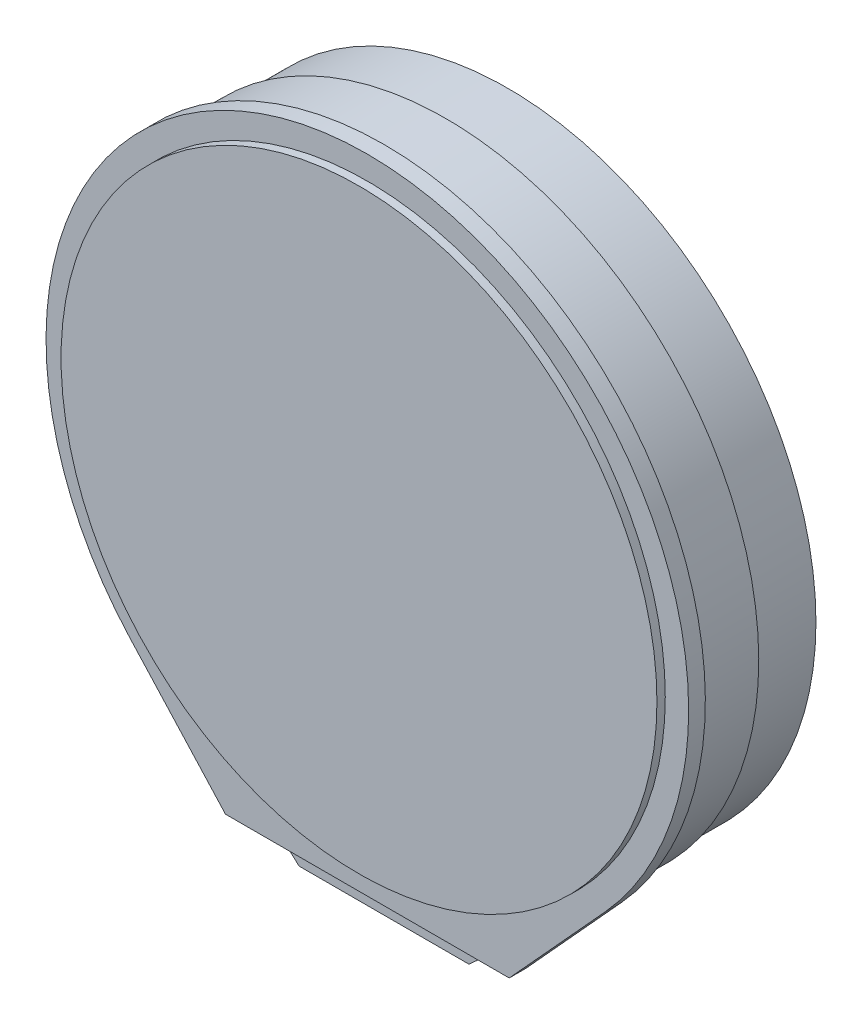
from build123d import *

# Parameters (mm, degrees)
EXTRUDE_1_DEPTH             = 3.7
EXTRUDE_2_DEPTH             = 1
SKETCH_3_R                  = 17.85
EXTRUDE_3_DEPTH             = 0.5
SKETCH_4_R                  = 18.476621058
EXTRUDE_4_DEPTH             = 7.4
EXTRUDE_5_DEPTH             = 0.85
EXTRUDE_5_DIRECTION_2_REACH = 46.995


with BuildPart() as part:
    # ｽｹｯﾁ1 → ﾎﾞｽ - 押し出し1 (new body)
    with BuildSketch(Plane.XY):
        with BuildLine():
            Line((-12.64, -13.848931367), (-5.089846792, -20.74))
            Line((-5.089846792, -20.74), (5.089846792, -20.74))
            Line((5.089846792, -20.74), (12.64, -13.848931367))
            ThreePointArc((12.64, -13.848931367), (0, 18.75), (-12.64, -13.848931367))
        make_face()
    extrude(amount=-EXTRUDE_1_DEPTH)

    # ｽｹｯﾁ2 → ﾎﾞｽ - 押し出し2 (add)
    with BuildSketch(Plane.XY):
        with BuildLine():
            Line((-14.226252646, -12.968278052), (-8.5, -19.25))
            Line((-8.5, -19.25), (8.5, -19.25))
            Line((8.5, -19.25), (14.226252646, -12.968278052))
            ThreePointArc((14.226252646, -12.968278052), (0, 19.25), (-14.226252646, -12.968278052))
        make_face()
    extrude(amount=EXTRUDE_2_DEPTH)

    # ｽｹｯﾁ3 → ﾎﾞｽ - 押し出し3 (add)
    with BuildSketch(Plane.XY.offset(1)):
        Circle(SKETCH_3_R)
    extrude(amount=EXTRUDE_3_DEPTH)

    # ｽｹｯﾁ4 → ﾎﾞｽ - 押し出し4 (add)
    with BuildSketch(Plane.XY):
        Circle(SKETCH_4_R)
    extrude(amount=-EXTRUDE_4_DEPTH)

    # ｽｹｯﾁ5 → ﾎﾞｽ - 押し出し5 (add)
    with BuildSketch(Plane.XZ.offset(20.74)):
        with BuildLine():
            Line((-2.9, -3.7), (2.9, -3.7))
            ThreePointArc((2.9, -3.7), (4.5, -5.3), (2.9, -6.9))
            Line((2.9, -6.9), (-2.9, -6.9))
            ThreePointArc((-2.9, -6.9), (-4.5, -5.3), (-2.9, -3.7))
        make_face()
    extrude(amount=EXTRUDE_5_DEPTH)

    # ｽｹｯﾁ5 → ﾎﾞｽ - 押し出し5 direction 2 (add, up to next)
    with BuildSketch(Plane.XZ.offset(20.74), mode=Mode.PRIVATE) as extrude_5_direction_2_sk1:
        with BuildLine():
            Line((-2.9, -3.7), (2.9, -3.7))
            ThreePointArc((2.9, -3.7), (4.5, -5.3), (2.9, -6.9))
            Line((2.9, -6.9), (-2.9, -6.9))
            ThreePointArc((-2.9, -6.9), (-4.5, -5.3), (-2.9, -3.7))
        make_face()
    extrude_5_direction_2_tool1 = extrude(extrude_5_direction_2_sk1.sketch, amount=-EXTRUDE_5_DIRECTION_2_REACH, mode=Mode.PRIVATE) - part.part
    add(extrude_5_direction_2_tool1.solids().sort_by_distance((0, -20.74, -5.3))[0])


solid = part.part
